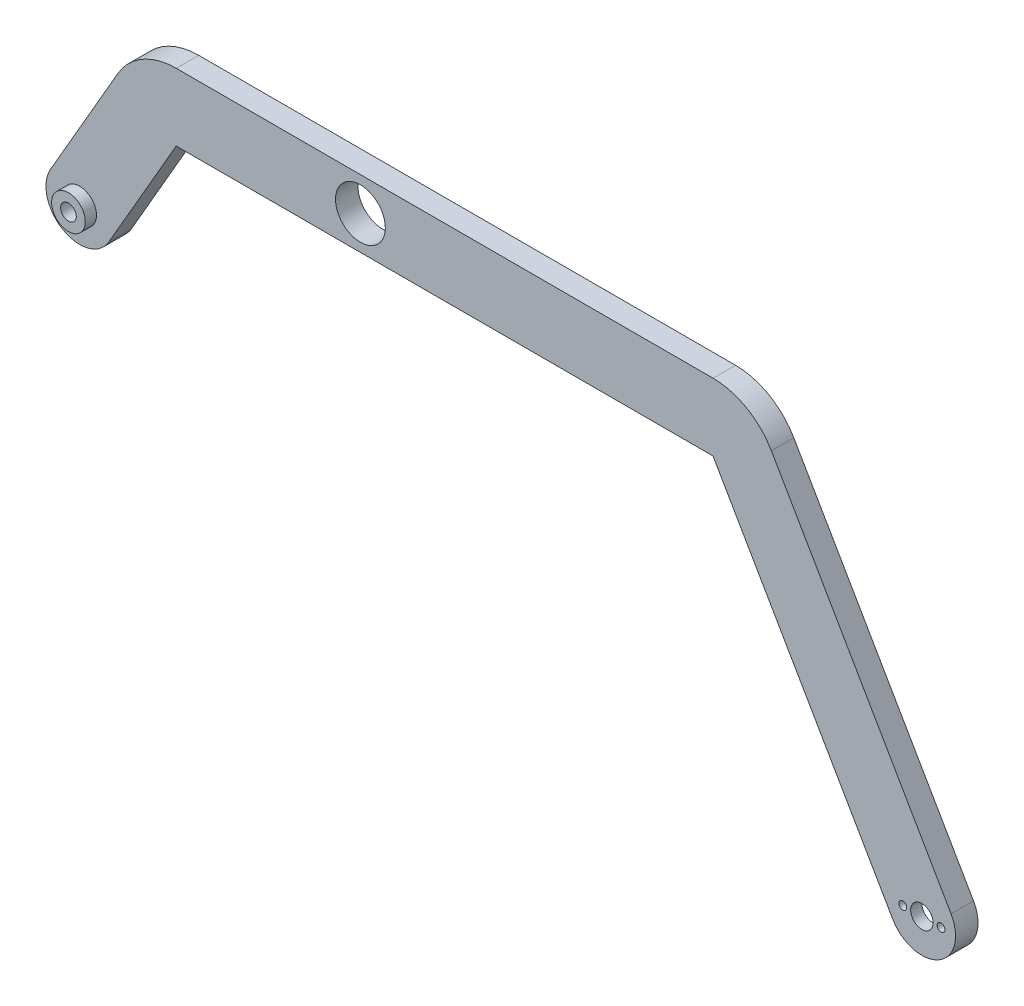
from build123d import *

# Parameters (mm, degrees)
SKETCH1_R           = 1.75
BOSS_EXTRUDE1_DEPTH = 10
SKETCH2_R           = 5
SKETCH2_R_2         = 11.0875
CUT_EXTRUDE1_DEPTH  = 10
SKETCH4_R           = 13
CUT_EXTRUDE2_DEPTH  = 5
SKETCH8_R           = 7.5
BOSS_EXTRUDE2_DEPTH = 5
SKETCH9_R           = 3.5
CUT_EXTRUDE3_DEPTH  = 311.470019337


with BuildPart() as part:
    # Sketch1 → Boss-Extrude1 (new body)
    with BuildSketch(Plane.XY):
        with BuildLine():
            Line((-82.009618943, -15), (-112.009618943, -66.961524227))
            ThreePointArc((-112.009618943, -66.961524227), (-132.5, -72.451905284), (-137.990381057, -51.961524227))
            Line((-137.990381057, -51.961524227), (-107.990381057, 0))
            ThreePointArc((-107.990381057, 0), (-97.009618943, 10.980762114), (-82.009618943, 15))
            Line((-82.009618943, 15), (0, 15))
            Line((0, 15), (157.009618943, 15))
            ThreePointArc((157.009618943, 15), (172.009618943, 10.980762114), (182.990381057, 0))
            Line((182.990381057, 0), (262.990381057, -138.564064606))
            ThreePointArc((262.990381057, -138.564064606), (257.5, -159.054445662), (237.009618943, -153.564064606))
            Line((237.009618943, -153.564064606), (157.009618943, -15))
            Line((157.009618943, -15), (0, -15))
            Line((0, -15), (-82.009618943, -15))
        make_face()
        with Locations((258.499974642, -146.04330206)):
            Circle(SKETCH1_R, mode=Mode.SUBTRACT)
        with Locations((241.500025358, -146.084827151)):
            Circle(SKETCH1_R, mode=Mode.SUBTRACT)
    extrude(amount=BOSS_EXTRUDE1_DEPTH)

    # Sketch2 → Cut-Extrude1 (cut)
    with BuildSketch(Plane.XY.offset(10)):
        with Locations((250, -146.064064606)):
            Circle(SKETCH2_R)
        Circle(SKETCH2_R_2)
    extrude(amount=-CUT_EXTRUDE1_DEPTH, mode=Mode.SUBTRACT)

    # Sketch4 → Cut-Extrude2 (cut)
    with BuildSketch(Plane(origin=(0, 0, 0), x_dir=(-1, 0, 0), z_dir=(0, 0, -1))):
        with Locations((-250, -146.064064606)):
            Circle(SKETCH4_R)
    extrude(amount=-CUT_EXTRUDE2_DEPTH, mode=Mode.SUBTRACT)

    # Sketch8 → Boss-Extrude2 (add)
    with BuildSketch(Plane.XY.offset(10)):
        with Locations(Location((-125, -59.461524227, 0), (0, 0, 180))):
            Circle(SKETCH8_R)
    extrude(amount=BOSS_EXTRUDE2_DEPTH)

    # Sketch9 → Cut-Extrude3 (cut, through all)
    with BuildSketch(Plane.XY.offset(15)):
        with Locations((-125, -59.461524227)):
            Circle(SKETCH9_R)
    extrude(amount=-CUT_EXTRUDE3_DEPTH, mode=Mode.SUBTRACT)


solid = part.part
